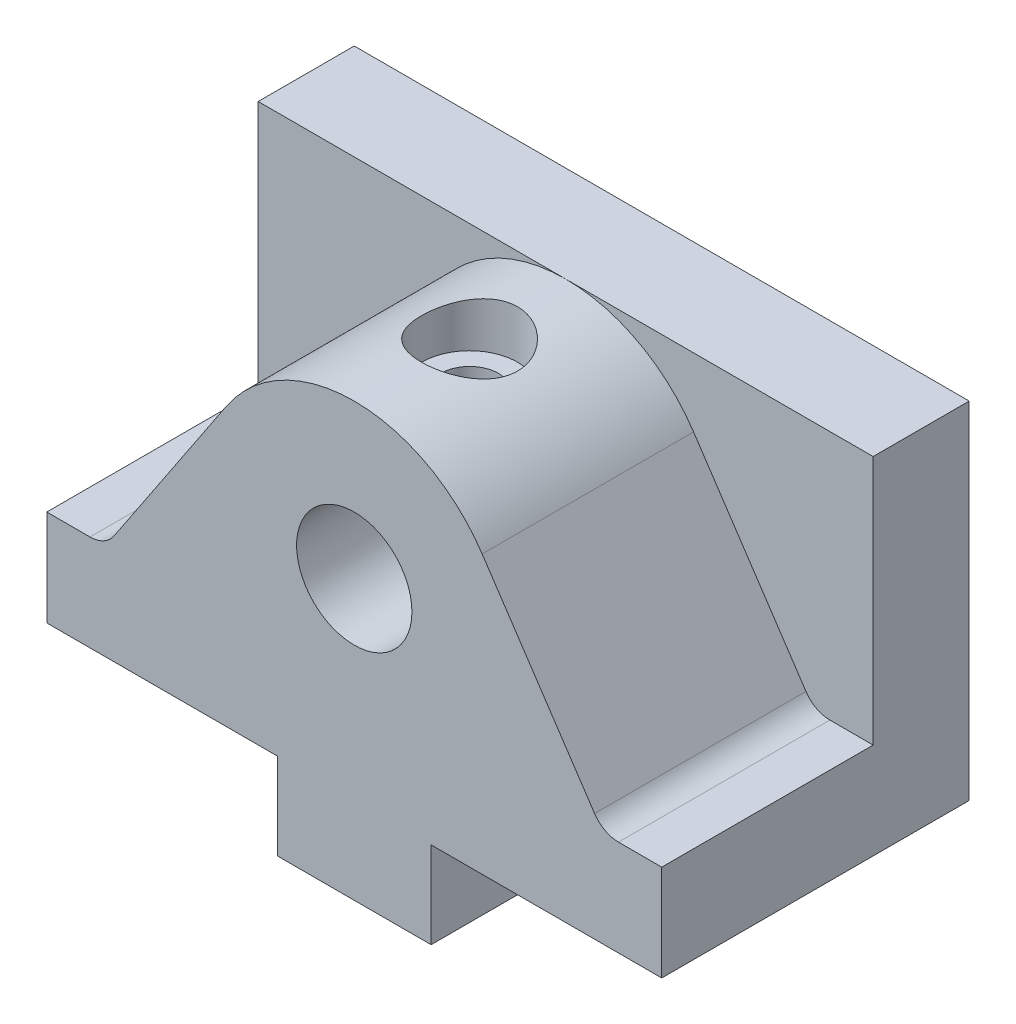
from build123d import *

# Parameters (mm, degrees)
SKETCH1_W                               = 64
SKETCH1_H                               = 36
BOSS_EXTRUDE1_DEPTH                     = 16
CUT_EXTRUDE1_DEPTH                      = 22
SKETCH3_R                               = 6
CUT_EXTRUDE2_DEPTH                      = 24
SKETCH4_W                               = 16
SKETCH4_H                               = 9
BOSS_EXTRUDE3_DEPTH                     = 32
F_6_0MM_DOWEL_HOLE1_D                   = 6
F_6_0MM_DOWEL_HOLE1_DEPTH               = 16
F_6_0MM_DOWEL_HOLE1_TIP                 = 1.802581857
CBORE_FOR_M6_HEX_HEAD_BOLT2_D           = 6
CBORE_FOR_M6_HEX_HEAD_BOLT2_DEPTH       = 13
CBORE_FOR_M6_HEX_HEAD_BOLT2_CBORE_D     = 10
CBORE_FOR_M6_HEX_HEAD_BOLT2_CBORE_DEPTH = 5
CBORE_FOR_M6_HEX_HEAD_BOLT2_TIP         = 1.802581857


with BuildPart() as part:
    # Sketch1 → Boss-Extrude1 (new, symmetric)
    with BuildSketch(Plane.XY):
        Rectangle(SKETCH1_W, SKETCH1_H)
    extrude(amount=BOSS_EXTRUDE1_DEPTH, both=True)

    # Sketch2 → Cut-Extrude1 (cut)
    with BuildSketch(Plane.XY.offset(16)):
        with BuildLine():
            Line((-32, -8), (-27.499996562, -8))
            ThreePointArc((-27.499996562, -8), (-26.084327344, -7.644972715), (-25.003725591, -6.663920443))
            Line((-25.003725591, -6.663920443), (-13.313445176, 10.874242365))
            ThreePointArc((-13.313445176, 10.874242365), (-0.000751694, 17.999999982), (13.312611277, 10.875493281))
            Line((13.312611277, 10.875493281), (25.007578247, -6.666128828))
            ThreePointArc((25.007578247, -6.666128828), (26.086521715, -7.646142127), (27.500003403, -8.001971569))
            Line((27.500003403, -8.001971569), (32, -8.007505757))
            Line((32, -8.007505757), (36.662231921, -8.007505757))
            Line((36.662231921, -8.007505757), (36.662231921, 30.154585716))
            Line((36.662231921, 30.154585716), (-48.36652886, 30.154585716))
            Line((-48.36652886, 30.154585716), (-48.36652886, -8))
            Line((-48.36652886, -8), (-32, -8))
        make_face()
    extrude(amount=-CUT_EXTRUDE1_DEPTH, mode=Mode.SUBTRACT)

    # Sketch3 → Cut-Extrude2 (cut)
    with BuildSketch(Plane.XY.offset(16)):
        with Locations((0, 2)):
            Circle(SKETCH3_R)
    extrude(amount=-CUT_EXTRUDE2_DEPTH, mode=Mode.SUBTRACT)

    # Sketch4 → Boss-Extrude3 (add)
    with BuildSketch(Plane.XY.offset(16)):
        with Locations((0, -22.5)):
            Rectangle(SKETCH4_W, SKETCH4_H)
    extrude(amount=-BOSS_EXTRUDE3_DEPTH)

    # Ø6.0mm Dowel Hole1
    with Locations(Plane(origin=(0, -27, 8), x_dir=(0, 0, -1), z_dir=(0, -1, 0))):
        with Locations((0, 0), (16, 0)):
            Hole(F_6_0MM_DOWEL_HOLE1_D / 2, depth=F_6_0MM_DOWEL_HOLE1_DEPTH)
            with Locations((0, 0, -(F_6_0MM_DOWEL_HOLE1_DEPTH + F_6_0MM_DOWEL_HOLE1_TIP / 2))):  # 118° drill point
                Cone(0, F_6_0MM_DOWEL_HOLE1_D / 2, F_6_0MM_DOWEL_HOLE1_TIP, mode=Mode.SUBTRACT)

    # CBORE for M6 Hex Head Bolt2
    with Locations(Plane(origin=(0, 18, 0), x_dir=(1, 0, 0), z_dir=(0, 1, 0))):
        with Locations((0, -4)):
            CounterBoreHole(CBORE_FOR_M6_HEX_HEAD_BOLT2_D / 2, CBORE_FOR_M6_HEX_HEAD_BOLT2_CBORE_D / 2, CBORE_FOR_M6_HEX_HEAD_BOLT2_CBORE_DEPTH, depth=CBORE_FOR_M6_HEX_HEAD_BOLT2_DEPTH)
            with Locations((0, 0, -(CBORE_FOR_M6_HEX_HEAD_BOLT2_DEPTH + CBORE_FOR_M6_HEX_HEAD_BOLT2_TIP / 2))):  # 118° drill point
                Cone(0, CBORE_FOR_M6_HEX_HEAD_BOLT2_D / 2, CBORE_FOR_M6_HEX_HEAD_BOLT2_TIP, mode=Mode.SUBTRACT)


solid = part.part
